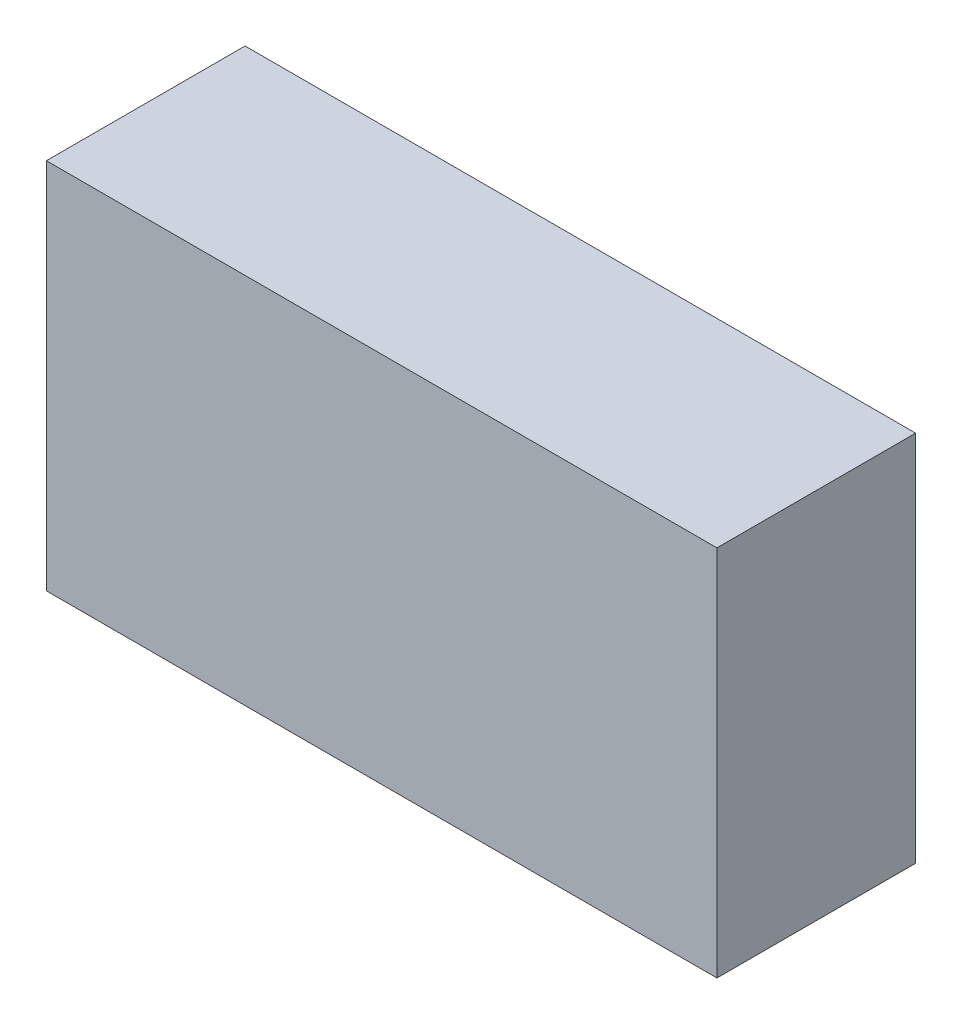
from build123d import *

# Parameters (mm, degrees)
SKETCH1_W           = 54
SKETCH1_H           = 30
BOSS_EXTRUDE1_DEPTH = 16
BOSS_EXTRUDE2_DEPTH = 0.5


with BuildPart() as part:
    # Sketch1 → Boss-Extrude1 (new body)
    with BuildSketch(Plane.XY):
        Rectangle(SKETCH1_W, SKETCH1_H)
    extrude(amount=BOSS_EXTRUDE1_DEPTH)

    # Sketch2 → Boss-Extrude2 (add)
    # profile 1 of 11: a face of its own
    with BuildSketch(Plane(origin=(0, 0, 0), x_dir=(-1, 0, 0), z_dir=(0, 0, -1))):
        Polygon((-12.786080321, 6.26738711), (-10.832234167, 6.26738711), (-12.501144423, 3.010976854), (-12.747283245, 3.146448608), (-11.314335529, 5.941746084), (-12.786080321, 5.941746084), align=None)
    # profile 2 of 11: a face of its own
    with BuildSketch(Plane(origin=(0, 0, 0), x_dir=(-1, 0, 0), z_dir=(0, 0, -1))):
        with BuildLine():
            add(Edge.make_bspline(
                [(-10.038484167, 3.580848648), (-10.02080376, 3.579798026), (-9.98614339, 3.577738403), (-9.936033609, 3.563608135), (-9.890681311, 3.538517778), (-9.850284203, 3.505077972), (-9.816986185, 3.464532621), (-9.791001665, 3.419542046), (-9.776994486, 3.369012745), (-9.774949866, 3.334151539), (-9.773900834, 3.316265315)],
                knots=[0, 0, 0, 0, 1.020151414, 1.999887582, 2.974338812, 3.990962822, 5.007586832, 5.987933904, 6.967670073, 8, 8, 8, 8], degree=3))
            add(Edge.make_bspline(
                [(-9.773900834, 3.316265315), (-9.774985414, 3.298808866), (-9.777124191, 3.264385005), (-9.790969557, 3.214236821), (-9.817184217, 3.169218129), (-9.850054532, 3.128122618), (-9.890691297, 3.094611971), (-9.936140829, 3.06973508), (-9.986025756, 3.054593069), (-10.020784135, 3.052664214), (-10.038484167, 3.051681982)],
                knots=[0, 0, 0, 0, 1.009421747, 1.99056486, 2.972319754, 3.999869655, 5.017953583, 5.993804169, 6.978383603, 8, 8, 8, 8], degree=3))
            add(Edge.make_bspline(
                [(-10.038484167, 3.051681982), (-10.056196953, 3.052628674), (-10.090776951, 3.054476864), (-10.140475674, 3.070045981), (-10.186201995, 3.094378691), (-10.226830848, 3.128185102), (-10.259976462, 3.169006661), (-10.28503663, 3.214546862), (-10.300086265, 3.264241451), (-10.302065536, 3.298780592), (-10.3030675, 3.316265315)],
                knots=[0, 0, 0, 0, 1.022052826, 1.995314843, 2.982371812, 4.00089066, 5.028879526, 6.005146991, 6.990147033, 8, 8, 8, 8], degree=3))
            add(Edge.make_bspline(
                [(-10.3030675, 3.316265315), (-10.302104024, 3.334180824), (-10.300222956, 3.369158656), (-10.285005036, 3.419232132), (-10.260170901, 3.464742073), (-10.226601721, 3.505016114), (-10.186211824, 3.53875031), (-10.140585981, 3.563301943), (-10.090657255, 3.577852889), (-10.056176811, 3.579832743), (-10.038484167, 3.580848648)],
                knots=[0, 0, 0, 0, 1.032775665, 2.016367738, 2.991239715, 4.008302682, 5.025365648, 6.011011707, 6.979408107, 8, 8, 8, 8], degree=3))
        make_face()
    # profile 3 of 11: a face of its own
    with BuildSketch(Plane(origin=(0, 0, 0), x_dir=(-1, 0, 0), z_dir=(0, 0, -1))):
        Polygon((-7.633701515, 6.348797366), (-7.57582391, 6.348797366), (-7.57582391, 4.150720443), (-7.209477757, 4.150720443), (-7.209477757, 3.825079418), (-7.57582391, 3.825079418), (-7.57582391, 3.09238711), (-7.860759808, 3.09238711), (-7.860759808, 3.825079418), (-9.366849551, 3.825079418), align=None)
        Polygon((-7.860759808, 4.150720443), (-7.860759808, 5.529606661), (-8.807154039, 4.150720443), align=None, mode=Mode.SUBTRACT)
    # profile 4 of 11: a face of its own
    with BuildSketch(Plane(origin=(0, 0, 0), x_dir=(-1, 0, 0), z_dir=(0, 0, -1))):
        Polygon((-6.883836731, 6.26738711), (-6.578548269, 6.26738711), (-5.520214936, 3.765293761), (-4.461881603, 6.26738711), (-4.156593141, 6.26738711), (-5.499862372, 3.09238711), (-5.5405675, 3.09238711), align=None)
    # profile 5 of 11: a face of its own
    with BuildSketch(Plane(origin=(0, 0, 0), x_dir=(-1, 0, 0), z_dir=(0, 0, -1))):
        Polygon((-12.314791258, -0.024279557), (-11.727746987, -0.024279557), (-11.727746987, -3.199279557), (-12.012682885, -3.199279557), (-12.012682885, -0.349920582), (-12.501144423, -0.349920582), align=None)
    # profile 6 of 11: a face of its own
    with BuildSketch(Plane(origin=(0, 0, 0), x_dir=(-1, 0, 0), z_dir=(0, 0, -1))):
        with BuildLine():
            add(Edge.make_bspline(
                [(-10.547298269, -1.613051592), (-10.54700071, -1.562163247), (-10.546422697, -1.463311904), (-10.539992486, -1.319271551), (-10.529310569, -1.184143288), (-10.514671666, -1.05792065), (-10.496857213, -0.940571049), (-10.473076021, -0.832408091), (-10.44603155, -0.732931162), (-10.414687546, -0.641815875), (-10.379320052, -0.557834673), (-10.340826115, -0.479434669), (-10.297678052, -0.406734488), (-10.252341852, -0.338573778), (-10.20298233, -0.276068283), (-10.151004141, -0.218335297), (-10.094378582, -0.166709116), (-10.035030568, -0.119677113), (-9.972422775, -0.078447949), (-9.908339785, -0.042132537), (-9.84234051, -0.011108371), (-9.774244759, 0.013285096), (-9.704664581, 0.033433507), (-9.633356742, 0.047212052), (-9.560203505, 0.055881533), (-9.510826417, 0.05671036), (-9.485784848, 0.0571307)],
                knots=[0, 0, 0, 0, 1.646270934, 3.197905019, 4.663502075, 6.030701355, 7.308322542, 8.50163776, 9.611534131, 10.641858119, 11.616356847, 12.558055219, 13.465016945, 14.349605745, 15.204443733, 16.039544428, 16.859896111, 17.680448484, 18.487036065, 19.28249412, 20.06191084, 20.843045899, 21.620316918, 22.403196591, 23.190181807, 24, 24, 24, 24], degree=3))
            add(Edge.make_bspline(
                [(-9.485784848, 0.0571307), (-9.460534092, 0.056688182), (-9.410318284, 0.055808153), (-9.336077373, 0.047350005), (-9.26355159, 0.033315486), (-9.193050135, 0.01343003), (-9.123993898, -0.011240334), (-9.056923014, -0.042162218), (-8.991420875, -0.078156619), (-8.9285284, -0.120451137), (-8.867555142, -0.167606487), (-8.809998776, -0.220912623), (-8.755854062, -0.279831296), (-8.704441464, -0.34373213), (-8.6572196, -0.413840743), (-8.612249415, -0.488937757), (-8.57199764, -0.57033647), (-8.533231185, -0.656678751), (-8.499769418, -0.750353642), (-8.469592181, -0.850833103), (-8.445209117, -0.959303973), (-8.424898848, -1.075197138), (-8.40916455, -1.198938212), (-8.397704939, -1.330261941), (-8.391651498, -1.469254724), (-8.39051149, -1.564285059), (-8.389926475, -1.613051592)],
                knots=[0, 0, 0, 0, 0.810914788, 1.612654377, 2.396697861, 3.181598691, 3.963628158, 4.749916497, 5.551656086, 6.361998678, 7.18212741, 8.025565596, 8.878627764, 9.750805457, 10.657531673, 11.591944965, 12.560506719, 13.57287815, 14.630710178, 15.753379473, 16.941251878, 18.199788006, 19.531962791, 20.947069417, 22.433333509, 24, 24, 24, 24], degree=3))
            add(Edge.make_bspline(
                [(-8.389926475, -1.613051592), (-8.390517555, -1.661605423), (-8.391669251, -1.756210582), (-8.397637077, -1.894577967), (-8.409392407, -2.025204763), (-8.424097182, -2.148404254), (-8.444463413, -2.263663665), (-8.469505242, -2.371381844), (-8.497309464, -2.472023966), (-8.531631027, -2.564765545), (-8.569196457, -2.650900322), (-8.610067956, -2.731334092), (-8.653855584, -2.806777801), (-8.701561089, -2.876627571), (-8.752409542, -2.94137821), (-8.807489251, -2.999886768), (-8.865247567, -3.05356302), (-8.926400259, -3.101325568), (-8.990273594, -3.143131069), (-9.055550757, -3.180517919), (-9.123389969, -3.210664721), (-9.192253862, -3.23655008), (-9.263127451, -3.256326204), (-9.335922391, -3.270000344), (-9.410268405, -3.279590521), (-9.460525539, -3.280322114), (-9.485784848, -3.280689813)],
                knots=[0, 0, 0, 0, 1.561518951, 3.042555995, 4.452378317, 5.7783523, 7.031515105, 8.214008947, 9.334062868, 10.386615937, 11.391082383, 12.354592575, 13.286541444, 14.194233754, 15.072674879, 15.931287219, 16.775624067, 17.606195743, 18.42308326, 19.229000347, 20.022332153, 20.807536673, 21.593273796, 22.3848459, 23.188221202, 24, 24, 24, 24], degree=3))
            add(Edge.make_bspline(
                [(-9.485784848, -3.280689813), (-9.510825723, -3.280266762), (-9.56020144, -3.279432588), (-9.633364712, -3.270802274), (-9.704378071, -3.256927068), (-9.773591941, -3.237499149), (-9.841361423, -3.213718547), (-9.906763054, -3.182736277), (-9.970524024, -3.147054657), (-10.032474221, -3.106418811), (-10.091449539, -3.059862712), (-10.147781845, -3.008369393), (-10.20005597, -2.95065387), (-10.248709756, -2.887627469), (-10.294950536, -2.819870027), (-10.337485897, -2.746456432), (-10.376829457, -2.667677778), (-10.412791766, -2.583025102), (-10.444676625, -2.491263132), (-10.472841332, -2.391342091), (-10.495079175, -2.28238005), (-10.514113713, -2.165252152), (-10.529466546, -2.039455087), (-10.53994797, -1.90492056), (-10.546426163, -1.761732406), (-10.547002262, -1.663516253), (-10.547298269, -1.613051592)],
                knots=[0, 0, 0, 0, 0.810891512, 1.598919785, 2.382837074, 3.152667961, 3.926044502, 4.706494248, 5.493654104, 6.291793342, 7.103789334, 7.925228297, 8.761435821, 9.622817696, 10.50288917, 11.416980706, 12.369136599, 13.353924996, 14.394355917, 15.514179734, 16.714354668, 17.994756427, 19.357759367, 20.818452758, 22.365282078, 24, 24, 24, 24], degree=3))
        make_face()
        with BuildLine():
            add(Edge.make_bspline(
                [(-10.262362372, -1.611779557), (-10.262254016, -1.654187305), (-10.26204372, -1.736492417), (-10.25654988, -1.856093089), (-10.249065741, -1.967644745), (-10.239412565, -2.071289024), (-10.225077033, -2.166675107), (-10.209014447, -2.254459034), (-10.189467251, -2.334176242), (-10.166339628, -2.406373756), (-10.139997018, -2.472276839), (-10.111235271, -2.533600799), (-10.080337329, -2.591070055), (-10.045757814, -2.6441684), (-10.008097721, -2.693068992), (-9.968207693, -2.738637347), (-9.924598992, -2.779274609), (-9.864270597, -2.828012541), (-9.784626652, -2.878376327), (-9.684278096, -2.922233137), (-9.581164573, -2.949794365), (-9.511177367, -2.953299344), (-9.476244584, -2.955048787)],
                knots=[0, 0, 0, 0, 1.459021318, 2.831673884, 4.118529203, 5.306027144, 6.411944654, 7.436330062, 8.375795394, 9.233974572, 10.042671642, 10.816086306, 11.563610507, 12.285937304, 12.993564865, 13.685989202, 14.367179055, 15.041617293, 16.353048772, 17.594441528, 18.799311195, 20, 20, 20, 20], degree=3))
            add(Edge.make_bspline(
                [(-9.476244584, -2.955048787), (-9.441085839, -2.953599372), (-9.370840938, -2.950703534), (-9.268212424, -2.922764679), (-9.168580679, -2.880610168), (-9.090501133, -2.830764931), (-9.031099112, -2.783295661), (-8.988538699, -2.742823801), (-8.94947527, -2.697506693), (-8.912425673, -2.648612332), (-8.87844494, -2.595206578), (-8.847544808, -2.537546242), (-8.819347771, -2.475471202), (-8.803283137, -2.432137225), (-8.795069704, -2.40998168)],
                knots=[0, 0, 0, 0, 1.353760809, 2.704726607, 4.075137775, 5.516104923, 6.260822281, 7.007110065, 7.778089737, 8.566572457, 9.372053459, 10.217411131, 11.088608312, 12, 12, 12, 12], degree=3))
            add(Edge.make_bspline(
                [(-8.795069704, -2.40998168), (-8.785497743, -2.381651845), (-8.766062558, -2.32413013), (-8.741014734, -2.234900246), (-8.72128855, -2.141280596), (-8.703541783, -2.043830668), (-8.691428653, -1.941831797), (-8.681678851, -1.835599577), (-8.675936014, -1.725053913), (-8.675224133, -1.649947028), (-8.674862372, -1.611779557)],
                knots=[0, 0, 0, 0, 0.884706709, 1.796334032, 2.740027952, 3.714592787, 4.726048262, 5.777819803, 6.87074269, 8, 8, 8, 8], degree=3))
            add(Edge.make_bspline(
                [(-8.674862372, -1.611779557), (-8.675361472, -1.573618259), (-8.676337819, -1.498966602), (-8.680069794, -1.389639395), (-8.689706893, -1.285800784), (-8.70041038, -1.187003426), (-8.716192144, -1.093794223), (-8.733208155, -1.005392875), (-8.756069255, -0.922894559), (-8.780489336, -0.845007653), (-8.808438767, -0.772617059), (-8.839205183, -0.705385268), (-8.872063492, -0.642987696), (-8.907752525, -0.585595542), (-8.945848609, -0.532951735), (-8.987357243, -0.486111781), (-9.030631924, -0.44362396), (-9.091244657, -0.395125772), (-9.170596334, -0.345675877), (-9.269334885, -0.300168367), (-9.372087541, -0.27403513), (-9.441550603, -0.270350599), (-9.476244584, -0.268510326)],
                knots=[0, 0, 0, 0, 1.31362396, 2.569729283, 3.763502607, 4.902122613, 5.988968491, 7.01645872, 7.998833611, 8.933434873, 9.825090667, 10.667526885, 11.477055099, 12.250526234, 12.991942729, 13.710640831, 14.402115721, 15.076753259, 16.378508321, 17.609869233, 18.806226677, 20, 20, 20, 20], degree=3))
            add(Edge.make_bspline(
                [(-9.476244584, -0.268510326), (-9.511360621, -0.270353138), (-9.581656668, -0.27404212), (-9.685477313, -0.300071), (-9.784994831, -0.345439905), (-9.864136673, -0.395289557), (-9.924791679, -0.442767882), (-9.967502408, -0.48393988), (-10.007549293, -0.528976125), (-10.044440707, -0.578326434), (-10.078993128, -0.631362874), (-10.110725904, -0.688502682), (-10.139316624, -0.750035419), (-10.165700453, -0.8159089), (-10.188898625, -0.888100185), (-10.208033863, -0.967719201), (-10.225711404, -1.055223917), (-10.238225684, -1.151126614), (-10.249350662, -1.254796853), (-10.256500171, -1.366626991), (-10.262062097, -1.486428251), (-10.262260276, -1.569158916), (-10.262362372, -1.611779557)],
                knots=[0, 0, 0, 0, 1.207732386, 2.417664972, 3.655092373, 4.956220595, 5.625982001, 6.301752483, 6.994047911, 7.697131622, 8.419323945, 9.170223765, 9.943494443, 10.752040957, 11.610060368, 12.549350801, 13.567764191, 14.679664412, 15.874934091, 17.154273443, 18.533957287, 20, 20, 20, 20], degree=3))
        make_face(mode=Mode.SUBTRACT)
    # profile 7 of 11: a face of its own
    with BuildSketch(Plane(origin=(0, 0, 0), x_dir=(-1, 0, 0), z_dir=(0, 0, -1))):
        with BuildLine():
            add(Edge.make_bspline(
                [(-8.104990577, -1.613051592), (-8.104693018, -1.562163247), (-8.104115005, -1.463311904), (-8.097684794, -1.319271551), (-8.087002876, -1.184143288), (-8.072363974, -1.05792065), (-8.05454952, -0.940571049), (-8.030768329, -0.832408091), (-8.003723858, -0.732931162), (-7.972379854, -0.641815875), (-7.937012359, -0.557834673), (-7.898518423, -0.479434669), (-7.855370359, -0.406734488), (-7.81003416, -0.338573778), (-7.760674638, -0.276068283), (-7.708696449, -0.218335297), (-7.65207089, -0.166709116), (-7.592722875, -0.119677113), (-7.530115083, -0.078447949), (-7.466032093, -0.042132537), (-7.400032818, -0.011108371), (-7.331937066, 0.013285096), (-7.262356889, 0.033433507), (-7.19104905, 0.047212052), (-7.117895812, 0.055881533), (-7.068518725, 0.05671036), (-7.043477156, 0.0571307)],
                knots=[0, 0, 0, 0, 1.646270934, 3.197905019, 4.663502075, 6.030701355, 7.308322542, 8.50163776, 9.611534131, 10.641858119, 11.616356847, 12.558055219, 13.465016945, 14.349605745, 15.204443733, 16.039544428, 16.859896111, 17.680448484, 18.487036065, 19.28249412, 20.06191084, 20.843045899, 21.620316918, 22.403196591, 23.190181807, 24, 24, 24, 24], degree=3))
            add(Edge.make_bspline(
                [(-7.043477156, 0.0571307), (-7.0182264, 0.056688182), (-6.968010592, 0.055808153), (-6.89376968, 0.047350005), (-6.821243898, 0.033315486), (-6.750742443, 0.01343003), (-6.681686205, -0.011240334), (-6.614615321, -0.042162218), (-6.549113183, -0.078156619), (-6.486220708, -0.120451137), (-6.42524745, -0.167606487), (-6.367691083, -0.220912623), (-6.31354637, -0.279831296), (-6.262133771, -0.34373213), (-6.214911908, -0.413840743), (-6.169941723, -0.488937757), (-6.129689948, -0.57033647), (-6.090923492, -0.656678751), (-6.057461726, -0.750353642), (-6.027284489, -0.850833103), (-6.002901425, -0.959303973), (-5.982591156, -1.075197138), (-5.966856858, -1.198938212), (-5.955397247, -1.330261941), (-5.949343805, -1.469254724), (-5.948203798, -1.564285059), (-5.947618782, -1.613051592)],
                knots=[0, 0, 0, 0, 0.810914788, 1.612654377, 2.396697861, 3.181598691, 3.963628158, 4.749916497, 5.551656086, 6.361998678, 7.18212741, 8.025565596, 8.878627764, 9.750805457, 10.657531673, 11.591944965, 12.560506719, 13.57287815, 14.630710178, 15.753379473, 16.941251878, 18.199788006, 19.531962791, 20.947069417, 22.433333509, 24, 24, 24, 24], degree=3))
            add(Edge.make_bspline(
                [(-5.947618782, -1.613051592), (-5.948209863, -1.661605423), (-5.949361558, -1.756210582), (-5.955329385, -1.894577967), (-5.967084715, -2.025204763), (-5.98178949, -2.148404254), (-6.002155721, -2.263663665), (-6.02719755, -2.371381844), (-6.055001771, -2.472023966), (-6.089323335, -2.564765545), (-6.126888765, -2.650900322), (-6.167760264, -2.731334092), (-6.211547892, -2.806777801), (-6.259253397, -2.876627571), (-6.31010185, -2.94137821), (-6.365181558, -2.999886768), (-6.422939875, -3.05356302), (-6.484092566, -3.101325568), (-6.547965902, -3.143131069), (-6.613243065, -3.180517919), (-6.681082277, -3.210664721), (-6.74994617, -3.23655008), (-6.820819759, -3.256326204), (-6.893614699, -3.270000344), (-6.967960713, -3.279590521), (-7.018217847, -3.280322114), (-7.043477156, -3.280689813)],
                knots=[0, 0, 0, 0, 1.561518951, 3.042555995, 4.452378317, 5.7783523, 7.031515105, 8.214008947, 9.334062868, 10.386615937, 11.391082383, 12.354592575, 13.286541444, 14.194233754, 15.072674879, 15.931287219, 16.775624067, 17.606195743, 18.42308326, 19.229000347, 20.022332153, 20.807536673, 21.593273796, 22.3848459, 23.188221202, 24, 24, 24, 24], degree=3))
            add(Edge.make_bspline(
                [(-7.043477156, -3.280689813), (-7.06851803, -3.280266762), (-7.117893748, -3.279432588), (-7.19105702, -3.270802274), (-7.262070379, -3.256927068), (-7.331284249, -3.237499149), (-7.39905373, -3.213718547), (-7.464455362, -3.182736277), (-7.528216332, -3.147054657), (-7.590166529, -3.106418811), (-7.649141847, -3.059862712), (-7.705474153, -3.008369393), (-7.757748277, -2.95065387), (-7.806402064, -2.887627469), (-7.852642844, -2.819870027), (-7.895178204, -2.746456432), (-7.934521765, -2.667677778), (-7.970484074, -2.583025102), (-8.002368933, -2.491263132), (-8.03053364, -2.391342091), (-8.052771483, -2.28238005), (-8.071806021, -2.165252152), (-8.087158854, -2.039455087), (-8.097640278, -1.90492056), (-8.10411847, -1.761732406), (-8.10469457, -1.663516253), (-8.104990577, -1.613051592)],
                knots=[0, 0, 0, 0, 0.810891512, 1.598919785, 2.382837074, 3.152667961, 3.926044502, 4.706494248, 5.493654104, 6.291793342, 7.103789334, 7.925228297, 8.761435821, 9.622817696, 10.50288917, 11.416980706, 12.369136599, 13.353924996, 14.394355917, 15.514179734, 16.714354668, 17.994756427, 19.357759367, 20.818452758, 22.365282078, 24, 24, 24, 24], degree=3))
        make_face()
        with BuildLine():
            add(Edge.make_bspline(
                [(-7.82005468, -1.611779557), (-7.819946324, -1.654187305), (-7.819736027, -1.736492417), (-7.814242188, -1.856093089), (-7.806758049, -1.967644745), (-7.797104872, -2.071289024), (-7.782769341, -2.166675107), (-7.766706754, -2.254459034), (-7.747159559, -2.334176242), (-7.724031936, -2.406373756), (-7.697689326, -2.472276839), (-7.668927578, -2.533600799), (-7.638029637, -2.591070055), (-7.603450122, -2.6441684), (-7.565790029, -2.693068992), (-7.525900001, -2.738637347), (-7.482291299, -2.779274609), (-7.421962904, -2.828012541), (-7.34231896, -2.878376327), (-7.241970404, -2.922233137), (-7.13885688, -2.949794365), (-7.068869675, -2.953299344), (-7.033936891, -2.955048787)],
                knots=[0, 0, 0, 0, 1.459021318, 2.831673884, 4.118529203, 5.306027144, 6.411944654, 7.436330062, 8.375795394, 9.233974572, 10.042671642, 10.816086306, 11.563610507, 12.285937304, 12.993564865, 13.685989202, 14.367179055, 15.041617293, 16.353048772, 17.594441528, 18.799311195, 20, 20, 20, 20], degree=3))
            add(Edge.make_bspline(
                [(-7.033936891, -2.955048787), (-6.998778146, -2.953599372), (-6.928533246, -2.950703534), (-6.825904732, -2.922764679), (-6.726272987, -2.880610168), (-6.648193441, -2.830764931), (-6.588791419, -2.783295661), (-6.546231007, -2.742823801), (-6.507167577, -2.697506693), (-6.470117981, -2.648612332), (-6.436137248, -2.595206578), (-6.405237116, -2.537546242), (-6.377040079, -2.475471202), (-6.360975444, -2.432137225), (-6.352762011, -2.40998168)],
                knots=[0, 0, 0, 0, 1.353760809, 2.704726607, 4.075137775, 5.516104923, 6.260822281, 7.007110065, 7.778089737, 8.566572457, 9.372053459, 10.217411131, 11.088608312, 12, 12, 12, 12], degree=3))
            add(Edge.make_bspline(
                [(-6.352762011, -2.40998168), (-6.343190051, -2.381651845), (-6.323754865, -2.32413013), (-6.298707041, -2.234900246), (-6.278980858, -2.141280596), (-6.26123409, -2.043830668), (-6.249120961, -1.941831797), (-6.239371159, -1.835599577), (-6.233628322, -1.725053913), (-6.23291644, -1.649947028), (-6.23255468, -1.611779557)],
                knots=[0, 0, 0, 0, 0.884706709, 1.796334032, 2.740027952, 3.714592787, 4.726048262, 5.777819803, 6.87074269, 8, 8, 8, 8], degree=3))
            add(Edge.make_bspline(
                [(-6.23255468, -1.611779557), (-6.23305378, -1.573618259), (-6.234030127, -1.498966602), (-6.237762101, -1.389639395), (-6.247399201, -1.285800784), (-6.258102687, -1.187003426), (-6.273884452, -1.093794223), (-6.290900463, -1.005392875), (-6.313761562, -0.922894559), (-6.338181644, -0.845007653), (-6.366131074, -0.772617059), (-6.39689749, -0.705385268), (-6.4297558, -0.642987696), (-6.465444832, -0.585595542), (-6.503540916, -0.532951735), (-6.54504955, -0.486111781), (-6.588324231, -0.44362396), (-6.648936964, -0.395125772), (-6.728288641, -0.345675877), (-6.827027193, -0.300168367), (-6.929779849, -0.27403513), (-6.999242911, -0.270350599), (-7.033936891, -0.268510326)],
                knots=[0, 0, 0, 0, 1.31362396, 2.569729283, 3.763502607, 4.902122613, 5.988968491, 7.01645872, 7.998833611, 8.933434873, 9.825090667, 10.667526885, 11.477055099, 12.250526234, 12.991942729, 13.710640831, 14.402115721, 15.076753259, 16.378508321, 17.609869233, 18.806226677, 20, 20, 20, 20], degree=3))
            add(Edge.make_bspline(
                [(-7.033936891, -0.268510326), (-7.069052928, -0.270353138), (-7.139348976, -0.27404212), (-7.24316962, -0.300071), (-7.342687139, -0.345439905), (-7.421828981, -0.395289557), (-7.482483987, -0.442767882), (-7.525194716, -0.48393988), (-7.565241601, -0.528976125), (-7.602133014, -0.578326434), (-7.636685436, -0.631362874), (-7.668418211, -0.688502682), (-7.697008932, -0.750035419), (-7.723392761, -0.8159089), (-7.746590933, -0.888100185), (-7.765726171, -0.967719201), (-7.783403712, -1.055223917), (-7.795917992, -1.151126614), (-7.80704297, -1.254796853), (-7.814192479, -1.366626991), (-7.819754405, -1.486428251), (-7.819952583, -1.569158916), (-7.82005468, -1.611779557)],
                knots=[0, 0, 0, 0, 1.207732386, 2.417664972, 3.655092373, 4.956220595, 5.625982001, 6.301752483, 6.994047911, 7.697131622, 8.419323945, 9.170223765, 9.943494443, 10.752040957, 11.610060368, 12.549350801, 13.567764191, 14.679664412, 15.874934091, 17.154273443, 18.533957287, 20, 20, 20, 20], degree=3))
        make_face(mode=Mode.SUBTRACT)
    # profile 8 of 11: a face of its own
    with BuildSketch(Plane(origin=(0, 0, 0), x_dir=(-1, 0, 0), z_dir=(0, 0, -1))):
        with BuildLine():
            add(Edge.make_bspline(
                [(-5.662682885, -1.613051592), (-5.662385325, -1.562163247), (-5.661807312, -1.463311904), (-5.655377102, -1.319271551), (-5.644695184, -1.184143288), (-5.630056282, -1.05792065), (-5.612241828, -0.940571049), (-5.588460637, -0.832408091), (-5.561416166, -0.732931162), (-5.530072161, -0.641815875), (-5.494704667, -0.557834673), (-5.45621073, -0.479434669), (-5.413062667, -0.406734488), (-5.367726467, -0.338573778), (-5.318366945, -0.276068283), (-5.266388757, -0.218335297), (-5.209763198, -0.166709116), (-5.150415183, -0.119677113), (-5.08780739, -0.078447949), (-5.0237244, -0.042132537), (-4.957725126, -0.011108371), (-4.889629374, 0.013285096), (-4.820049196, 0.033433507), (-4.748741357, 0.047212052), (-4.67558812, 0.055881533), (-4.626211033, 0.05671036), (-4.601169463, 0.0571307)],
                knots=[0, 0, 0, 0, 1.646270934, 3.197905019, 4.663502075, 6.030701355, 7.308322542, 8.50163776, 9.611534131, 10.641858119, 11.616356847, 12.558055219, 13.465016945, 14.349605745, 15.204443733, 16.039544428, 16.859896111, 17.680448484, 18.487036065, 19.28249412, 20.06191084, 20.843045899, 21.620316918, 22.403196591, 23.190181807, 24, 24, 24, 24], degree=3))
            add(Edge.make_bspline(
                [(-4.601169463, 0.0571307), (-4.575918708, 0.056688182), (-4.5257029, 0.055808153), (-4.451461988, 0.047350005), (-4.378936205, 0.033315486), (-4.308434751, 0.01343003), (-4.239378513, -0.011240334), (-4.172307629, -0.042162218), (-4.106805491, -0.078156619), (-4.043913016, -0.120451137), (-3.982939757, -0.167606487), (-3.925383391, -0.220912623), (-3.871238677, -0.279831296), (-3.819826079, -0.34373213), (-3.772604216, -0.413840743), (-3.727634031, -0.488937757), (-3.687382255, -0.57033647), (-3.6486158, -0.656678751), (-3.615154033, -0.750353642), (-3.584976797, -0.850833103), (-3.560593732, -0.959303973), (-3.540283464, -1.075197138), (-3.524549165, -1.198938212), (-3.513089554, -1.330261941), (-3.507036113, -1.469254724), (-3.505896105, -1.564285059), (-3.50531109, -1.613051592)],
                knots=[0, 0, 0, 0, 0.810914788, 1.612654377, 2.396697861, 3.181598691, 3.963628158, 4.749916497, 5.551656086, 6.361998678, 7.18212741, 8.025565596, 8.878627764, 9.750805457, 10.657531673, 11.591944965, 12.560506719, 13.57287815, 14.630710178, 15.753379473, 16.941251878, 18.199788006, 19.531962791, 20.947069417, 22.433333509, 24, 24, 24, 24], degree=3))
            add(Edge.make_bspline(
                [(-3.50531109, -1.613051592), (-3.50590217, -1.661605423), (-3.507053866, -1.756210582), (-3.513021693, -1.894577967), (-3.524777023, -2.025204763), (-3.539481798, -2.148404254), (-3.559848028, -2.263663665), (-3.584889858, -2.371381844), (-3.612694079, -2.472023966), (-3.647015642, -2.564765545), (-3.684581072, -2.650900322), (-3.725452572, -2.731334092), (-3.7692402, -2.806777801), (-3.816945704, -2.876627571), (-3.867794158, -2.94137821), (-3.922873866, -2.999886768), (-3.980632183, -3.05356302), (-4.041784874, -3.101325568), (-4.10565821, -3.143131069), (-4.170935372, -3.180517919), (-4.238774584, -3.210664721), (-4.307638477, -3.23655008), (-4.378512067, -3.256326204), (-4.451307007, -3.270000344), (-4.525653021, -3.279590521), (-4.575910155, -3.280322114), (-4.601169463, -3.280689813)],
                knots=[0, 0, 0, 0, 1.561518951, 3.042555995, 4.452378317, 5.7783523, 7.031515105, 8.214008947, 9.334062868, 10.386615937, 11.391082383, 12.354592575, 13.286541444, 14.194233754, 15.072674879, 15.931287219, 16.775624067, 17.606195743, 18.42308326, 19.229000347, 20.022332153, 20.807536673, 21.593273796, 22.3848459, 23.188221202, 24, 24, 24, 24], degree=3))
            add(Edge.make_bspline(
                [(-4.601169463, -3.280689813), (-4.626210338, -3.280266762), (-4.675586056, -3.279432588), (-4.748749327, -3.270802274), (-4.819762687, -3.256927068), (-4.888976556, -3.237499149), (-4.956746038, -3.213718547), (-5.022147669, -3.182736277), (-5.08590864, -3.147054657), (-5.147858837, -3.106418811), (-5.206834154, -3.059862712), (-5.263166461, -3.008369393), (-5.315440585, -2.95065387), (-5.364094372, -2.887627469), (-5.410335152, -2.819870027), (-5.452870512, -2.746456432), (-5.492214072, -2.667677778), (-5.528176382, -2.583025102), (-5.560061241, -2.491263132), (-5.588225947, -2.391342091), (-5.61046379, -2.28238005), (-5.629498328, -2.165252152), (-5.644851162, -2.039455087), (-5.655332585, -1.90492056), (-5.661810778, -1.761732406), (-5.662386878, -1.663516253), (-5.662682885, -1.613051592)],
                knots=[0, 0, 0, 0, 0.810891512, 1.598919785, 2.382837074, 3.152667961, 3.926044502, 4.706494248, 5.493654104, 6.291793342, 7.103789334, 7.925228297, 8.761435821, 9.622817696, 10.50288917, 11.416980706, 12.369136599, 13.353924996, 14.394355917, 15.514179734, 16.714354668, 17.994756427, 19.357759367, 20.818452758, 22.365282078, 24, 24, 24, 24], degree=3))
        make_face()
        with BuildLine():
            add(Edge.make_bspline(
                [(-5.377746987, -1.611779557), (-5.377638632, -1.654187305), (-5.377428335, -1.736492417), (-5.371934496, -1.856093089), (-5.364450357, -1.967644745), (-5.35479718, -2.071289024), (-5.340461648, -2.166675107), (-5.324399062, -2.254459034), (-5.304851867, -2.334176242), (-5.281724243, -2.406373756), (-5.255381634, -2.472276839), (-5.226619886, -2.533600799), (-5.195721945, -2.591070055), (-5.161142429, -2.6441684), (-5.123482336, -2.693068992), (-5.083592308, -2.738637347), (-5.039983607, -2.779274609), (-4.979655212, -2.828012541), (-4.900011267, -2.878376327), (-4.799662712, -2.922233137), (-4.696549188, -2.949794365), (-4.626561983, -2.953299344), (-4.591629199, -2.955048787)],
                knots=[0, 0, 0, 0, 1.459021318, 2.831673884, 4.118529203, 5.306027144, 6.411944654, 7.436330062, 8.375795394, 9.233974572, 10.042671642, 10.816086306, 11.563610507, 12.285937304, 12.993564865, 13.685989202, 14.367179055, 15.041617293, 16.353048772, 17.594441528, 18.799311195, 20, 20, 20, 20], degree=3))
            add(Edge.make_bspline(
                [(-4.591629199, -2.955048787), (-4.556470454, -2.953599372), (-4.486225554, -2.950703534), (-4.383597039, -2.922764679), (-4.283965294, -2.880610168), (-4.205885749, -2.830764931), (-4.146483727, -2.783295661), (-4.103923315, -2.742823801), (-4.064859885, -2.697506693), (-4.027810288, -2.648612332), (-3.993829555, -2.595206578), (-3.962929423, -2.537546242), (-3.934732387, -2.475471202), (-3.918667752, -2.432137225), (-3.910454319, -2.40998168)],
                knots=[0, 0, 0, 0, 1.353760809, 2.704726607, 4.075137775, 5.516104923, 6.260822281, 7.007110065, 7.778089737, 8.566572457, 9.372053459, 10.217411131, 11.088608312, 12, 12, 12, 12], degree=3))
            add(Edge.make_bspline(
                [(-3.910454319, -2.40998168), (-3.900882358, -2.381651845), (-3.881447173, -2.32413013), (-3.856399349, -2.234900246), (-3.836673166, -2.141280596), (-3.818926398, -2.043830668), (-3.806813269, -1.941831797), (-3.797063467, -1.835599577), (-3.791320629, -1.725053913), (-3.790608748, -1.649947028), (-3.790246987, -1.611779557)],
                knots=[0, 0, 0, 0, 0.884706709, 1.796334032, 2.740027952, 3.714592787, 4.726048262, 5.777819803, 6.87074269, 8, 8, 8, 8], degree=3))
            add(Edge.make_bspline(
                [(-3.790246987, -1.611779557), (-3.790746088, -1.573618259), (-3.791722434, -1.498966602), (-3.795454409, -1.389639395), (-3.805091509, -1.285800784), (-3.815794995, -1.187003426), (-3.83157676, -1.093794223), (-3.84859277, -1.005392875), (-3.87145387, -0.922894559), (-3.895873952, -0.845007653), (-3.923823382, -0.772617059), (-3.954589798, -0.705385268), (-3.987448108, -0.642987696), (-4.02313714, -0.585595542), (-4.061233224, -0.532951735), (-4.102741858, -0.486111781), (-4.146016539, -0.44362396), (-4.206629272, -0.395125772), (-4.285980949, -0.345675877), (-4.384719501, -0.300168367), (-4.487472156, -0.27403513), (-4.556935218, -0.270350599), (-4.591629199, -0.268510326)],
                knots=[0, 0, 0, 0, 1.31362396, 2.569729283, 3.763502607, 4.902122613, 5.988968491, 7.01645872, 7.998833611, 8.933434873, 9.825090667, 10.667526885, 11.477055099, 12.250526234, 12.991942729, 13.710640831, 14.402115721, 15.076753259, 16.378508321, 17.609869233, 18.806226677, 20, 20, 20, 20], degree=3))
            add(Edge.make_bspline(
                [(-4.591629199, -0.268510326), (-4.626745236, -0.270353138), (-4.697041283, -0.27404212), (-4.800861928, -0.300071), (-4.900379447, -0.345439905), (-4.979521288, -0.395289557), (-5.040176295, -0.442767882), (-5.082887024, -0.48393988), (-5.122933908, -0.528976125), (-5.159825322, -0.578326434), (-5.194377743, -0.631362874), (-5.226110519, -0.688502682), (-5.254701239, -0.750035419), (-5.281085069, -0.8159089), (-5.304283241, -0.888100185), (-5.323418479, -0.967719201), (-5.34109602, -1.055223917), (-5.353610299, -1.151126614), (-5.364735278, -1.254796853), (-5.371884786, -1.366626991), (-5.377446713, -1.486428251), (-5.377644891, -1.569158916), (-5.377746987, -1.611779557)],
                knots=[0, 0, 0, 0, 1.207732386, 2.417664972, 3.655092373, 4.956220595, 5.625982001, 6.301752483, 6.994047911, 7.697131622, 8.419323945, 9.170223765, 9.943494443, 10.752040957, 11.610060368, 12.549350801, 13.567764191, 14.679664412, 15.874934091, 17.154273443, 18.533957287, 20, 20, 20, 20], degree=3))
        make_face(mode=Mode.SUBTRACT)
    # profile 9 of 11: a face of its own
    with BuildSketch(Plane(origin=(0, 0, 0), x_dir=(-1, 0, 0), z_dir=(0, 0, -1))):
        with BuildLine():
            Line((-3.016849551, -0.879087249), (-2.731913654, -0.879087249))
            Line((-2.731913654, -0.879087249), (-2.731913654, -1.282322425))
            add(Edge.make_bspline(
                [(-2.731913654, -1.282322425), (-2.706256071, -1.247045815), (-2.657093682, -1.179452448), (-2.57647984, -1.090379833), (-2.495947224, -1.014789293), (-2.437950513, -0.975108259), (-2.410088734, -0.956045382)],
                knots=[0, 0, 0, 0, 1.134379233, 2.173579362, 3.122582517, 4, 4, 4, 4], degree=3))
            add(Edge.make_bspline(
                [(-2.410088734, -0.956045382), (-2.372111505, -0.937897658), (-2.296820553, -0.901919271), (-2.177604542, -0.865421686), (-2.055616806, -0.842992487), (-1.973240783, -0.839925098), (-1.931803478, -0.838382121)],
                knots=[0, 0, 0, 0, 1.014936303, 2.012140481, 3.000054389, 4, 4, 4, 4], degree=3))
            add(Edge.make_bspline(
                [(-1.931803478, -0.838382121), (-1.903779117, -0.839330349), (-1.848320413, -0.841206841), (-1.766147702, -0.853417016), (-1.68644739, -0.874522759), (-1.609690378, -0.903920831), (-1.537372333, -0.939523183), (-1.47106999, -0.981296846), (-1.411539458, -1.028193479), (-1.358810826, -1.082330797), (-1.311395352, -1.145228997), (-1.26778097, -1.218584423), (-1.227480956, -1.30404423), (-1.205145912, -1.366062449), (-1.193387011, -1.398713651)],
                knots=[0, 0, 0, 0, 1.009824226, 1.998387844, 2.986035974, 3.974953746, 4.955485308, 5.885931332, 6.793869504, 7.679848016, 8.601185859, 9.625726857, 10.749998409, 12, 12, 12, 12], degree=3))
            add(Edge.make_bspline(
                [(-1.193387011, -1.398713651), (-1.180948948, -1.376285071), (-1.156472585, -1.332148775), (-1.1153739, -1.269684494), (-1.072313827, -1.211258333), (-1.026925394, -1.156823933), (-0.979368805, -1.106650106), (-0.929420249, -1.060570967), (-0.877364054, -1.01838863), (-0.804981094, -0.969109764), (-0.710808229, -0.91676655), (-0.59207401, -0.871383604), (-0.468566355, -0.843338259), (-0.3847303, -0.840045083), (-0.342395425, -0.838382121)],
                knots=[0, 0, 0, 0, 0.86119277, 1.694706429, 2.50939023, 3.298075842, 4.073795165, 4.829715201, 5.57930267, 6.321991688, 7.768977793, 9.186738141, 10.579381044, 12, 12, 12, 12], degree=3))
            add(Edge.make_bspline(
                [(-0.342395425, -0.838382121), (-0.303495812, -0.839849171), (-0.227365493, -0.842720331), (-0.116533259, -0.865265982), (-0.013171764, -0.903980705), (0.082511012, -0.956806932), (0.168834557, -1.023190906), (0.243870066, -1.10217478), (0.307161753, -1.193199873), (0.34850809, -1.278826892), (0.376552651, -1.354423944), (0.393843914, -1.418836794), (0.409119923, -1.489731417), (0.42180291, -1.567192582), (0.431072596, -1.65149392), (0.437940317, -1.742497472), (0.442588583, -1.840273966), (0.442917035, -1.907734098), (0.443086346, -1.942508723)],
                knots=[0, 0, 0, 0, 1.209669288, 2.367440248, 3.500751976, 4.631527125, 5.755587489, 6.87532382, 8.007944318, 9.190864318, 9.82315674, 10.514484317, 11.263564316, 12.079023757, 12.955305781, 13.901327259, 14.918167583, 16, 16, 16, 16], degree=3))
            Line((0.443086346, -1.942508723), (0.443086346, -3.199279557))
            Line((0.443086346, -3.199279557), (0.158150449, -3.199279557))
            Line((0.158150449, -3.199279557), (0.158150449, -1.941236688))
            add(Edge.make_bspline(
                [(0.158150449, -1.941236688), (0.158079798, -1.911554453), (0.157944017, -1.854509712), (0.155500508, -1.772637845), (0.150896474, -1.698008693), (0.145512908, -1.630724013), (0.138034596, -1.570626897), (0.128377215, -1.517838061), (0.118146748, -1.471942246), (0.101150527, -1.421064189), (0.073983511, -1.364939069), (0.03260194, -1.304411254), (-0.019531656, -1.251723671), (-0.079729798, -1.205987055), (-0.14826303, -1.168799966), (-0.223796029, -1.142242443), (-0.305859847, -1.125802403), (-0.362667662, -1.124164089), (-0.3920048, -1.123318018)],
                knots=[0, 0, 0, 0, 1.253487763, 2.409012846, 3.458416907, 4.410876679, 5.259312806, 6.014470957, 6.676830364, 7.243083969, 8.276244668, 9.299465089, 10.325150304, 11.392391894, 12.482080715, 13.603491619, 14.762376348, 16, 16, 16, 16], degree=3))
            add(Edge.make_bspline(
                [(-0.3920048, -1.123318018), (-0.427991116, -1.124602675), (-0.499113756, -1.127141646), (-0.602932162, -1.153062231), (-0.702691584, -1.192142172), (-0.795415312, -1.24877733), (-0.88071195, -1.316639203), (-0.954099425, -1.397329193), (-1.014725764, -1.488614913), (-1.055777585, -1.573112278), (-1.081712166, -1.649012417), (-1.098836225, -1.715322176), (-1.112156159, -1.790689027), (-1.124647996, -1.874606536), (-1.132801149, -1.967652343), (-1.14021103, -2.069396035), (-1.143677098, -2.180143627), (-1.144161929, -2.256912123), (-1.144413654, -2.296770542)],
                knots=[0, 0, 0, 0, 1.090531906, 2.155305635, 3.229839962, 4.33261226, 5.44038871, 6.529323825, 7.629011124, 8.757537029, 9.370236727, 10.061839251, 10.834451254, 11.692844982, 12.636905849, 13.66920014, 14.789842145, 16, 16, 16, 16], degree=3))
            Line((-1.144413654, -2.296770542), (-1.144413654, -3.199279557))
            Line((-1.144413654, -3.199279557), (-1.429349551, -3.199279557))
            Line((-1.429349551, -3.199279557), (-1.429349551, -2.019466856))
            add(Edge.make_bspline(
                [(-1.429349551, -2.019466856), (-1.429421607, -1.986180774), (-1.429560234, -1.922141698), (-1.431988036, -1.830308293), (-1.436602328, -1.746777599), (-1.441936826, -1.671646699), (-1.449611416, -1.605052137), (-1.458328843, -1.546636892), (-1.468623654, -1.496547411), (-1.485668764, -1.441607769), (-1.511716889, -1.38108236), (-1.553616241, -1.316547291), (-1.605874546, -1.260061231), (-1.667170983, -1.211838652), (-1.736118995, -1.171977451), (-1.812303937, -1.143257533), (-1.895039822, -1.126544071), (-1.952078884, -1.124413649), (-1.981412853, -1.123318018)],
                knots=[0, 0, 0, 0, 1.320475261, 2.540461679, 3.643808994, 4.639130445, 5.527981419, 6.302341397, 6.981980563, 7.553956391, 8.582137848, 9.585246428, 10.591171744, 11.620968678, 12.668337649, 13.738356861, 14.836885341, 16, 16, 16, 16], degree=3))
            add(Edge.make_bspline(
                [(-1.981412853, -1.123318018), (-2.015898987, -1.124706364), (-2.084628629, -1.127473288), (-2.185595416, -1.152378237), (-2.283100286, -1.191389076), (-2.375587763, -1.245509055), (-2.460563597, -1.312546076), (-2.534956811, -1.391390303), (-2.597497531, -1.481060497), (-2.63898282, -1.56466688), (-2.66574215, -1.638665494), (-2.683517918, -1.701576711), (-2.698793864, -1.771426936), (-2.71014587, -1.848431672), (-2.721104532, -1.932089379), (-2.726393456, -2.022816809), (-2.731538373, -2.120536132), (-2.731785492, -2.188002655), (-2.731913654, -2.222992497)],
                knots=[0, 0, 0, 0, 1.098833095, 2.189935336, 3.297829714, 4.440610912, 5.596351641, 6.740013378, 7.886572111, 9.072425424, 9.705826452, 10.395263256, 11.156850408, 11.985370555, 12.878090359, 13.847760091, 14.883794034, 16, 16, 16, 16], degree=3))
            Line((-2.731913654, -2.222992497), (-2.731913654, -3.199279557))
            Line((-2.731913654, -3.199279557), (-3.016849551, -3.199279557))
            Line((-3.016849551, -3.199279557), (-3.016849551, -0.879087249))
        make_face()
    # profile 10 of 11: a face of its own
    with BuildSketch(Plane(origin=(0, 0, 0), x_dir=(-1, 0, 0), z_dir=(0, 0, -1))):
        Polygon((2.478342756, -0.024279557), (3.943727372, -3.199279557), (3.633986787, -3.199279557), (3.164605777, -2.181651352), (1.725297884, -2.181651352), (1.242560505, -3.199279557), (0.931547884, -3.199279557), (2.437637628, -0.024279557), align=None)
        Polygon((2.454810104, -0.643124709), (1.879850168, -1.856010326), (3.014505617, -1.856010326), align=None, mode=Mode.SUBTRACT)
    # profile 11 of 11: a face of its own
    with BuildSketch(Plane(origin=(0, 0, 0), x_dir=(-1, 0, 0), z_dir=(0, 0, -1))):
        with BuildLine():
            Line((4.43218891, 0.0571307), (4.717124808, 0.0571307))
            Line((4.717124808, 0.0571307), (4.717124808, -1.317303395))
            add(Edge.make_bspline(
                [(4.717124808, -1.317303395), (4.747711217, -1.279072782), (4.807264523, -1.204635821), (4.907500286, -1.107516027), (5.010434577, -1.02333442), (5.119622655, -0.956323363), (5.233061341, -0.903385641), (5.351229076, -0.865841133), (5.474147814, -0.842753353), (5.557627771, -0.839851931), (5.599917275, -0.838382121)],
                knots=[0, 0, 0, 0, 1.125788106, 2.19196713, 3.20547328, 4.180437432, 5.132270164, 6.079753143, 7.027236121, 8, 8, 8, 8], degree=3))
            add(Edge.make_bspline(
                [(5.599917275, -0.838382121), (5.642852703, -0.839965475), (5.726887692, -0.843064482), (5.849244447, -0.867569478), (5.963508955, -0.909440868), (6.069341541, -0.966742384), (6.164432517, -1.038109877), (6.248660517, -1.120507044), (6.317458956, -1.216005527), (6.364266726, -1.304230843), (6.394722603, -1.382733856), (6.414001046, -1.450076977), (6.430347033, -1.52511757), (6.444588936, -1.607817006), (6.454080899, -1.698572268), (6.461705089, -1.796973914), (6.467126586, -1.903016299), (6.467336685, -1.976422525), (6.46744532, -2.014378715)],
                knots=[0, 0, 0, 0, 1.235656852, 2.418478516, 3.575258207, 4.727955599, 5.870717718, 6.98870536, 8.107142894, 9.245821548, 9.854588956, 10.528768408, 11.260415777, 12.065282286, 12.943670737, 13.886611085, 14.907229059, 16, 16, 16, 16], degree=3))
            Line((6.46744532, -2.014378715), (6.46744532, -3.199279557))
            Line((6.46744532, -3.199279557), (6.182509423, -3.199279557))
            Line((6.182509423, -3.199279557), (6.182509423, -2.107873307))
            add(Edge.make_bspline(
                [(6.182509423, -2.107873307), (6.182336791, -2.076284171), (6.182006575, -2.01585953), (6.180914969, -1.929348846), (6.178478188, -1.850884495), (6.174540439, -1.780717946), (6.170399053, -1.718751377), (6.164699187, -1.665074778), (6.15806776, -1.619614425), (6.152108937, -1.592250797), (6.149436506, -1.579978675)],
                knots=[0, 0, 0, 0, 1.430932559, 2.737130458, 3.918967929, 4.986496826, 5.920444988, 6.731744033, 7.431208747, 8, 8, 8, 8], degree=3))
            add(Edge.make_bspline(
                [(6.149436506, -1.579978675), (6.139073084, -1.543970308), (6.119149465, -1.47474443), (6.072841657, -1.380707815), (6.015003125, -1.300530229), (5.944384538, -1.235293696), (5.862235165, -1.184120371), (5.76801934, -1.148680312), (5.662623793, -1.126684164), (5.588372815, -1.124471367), (5.549671883, -1.123318018)],
                knots=[0, 0, 0, 0, 1.090059168, 2.095632401, 3.037101401, 3.955032261, 4.878929692, 5.839099886, 6.873700383, 8, 8, 8, 8], degree=3))
            add(Edge.make_bspline(
                [(5.549671883, -1.123318018), (5.526750403, -1.123749661), (5.481389386, -1.12460387), (5.414125954, -1.133179906), (5.348876018, -1.147194101), (5.285011185, -1.166157504), (5.223884998, -1.191961669), (5.163715732, -1.221834055), (5.106208128, -1.258399401), (5.050340994, -1.299425633), (4.998345803, -1.344846058), (4.949970491, -1.392785796), (4.906846426, -1.443835227), (4.867777061, -1.497175333), (4.834051045, -1.553537745), (4.804611463, -1.612378948), (4.779632653, -1.673776323), (4.767220496, -1.716389415), (4.761010024, -1.737711047)],
                knots=[0, 0, 0, 0, 1.024319606, 2.027102035, 3.025350316, 4.005802111, 5.00026367, 5.987881639, 7.005602596, 8.042517216, 9.083927026, 10.089214625, 11.084353441, 12.06828073, 13.041928858, 14.016821737, 15.00770877, 16, 16, 16, 16], degree=3))
            add(Edge.make_bspline(
                [(4.761010024, -1.737711047), (4.757436401, -1.753151481), (4.749649036, -1.786798087), (4.741199151, -1.842291938), (4.733635578, -1.906777433), (4.727241537, -1.980156763), (4.72331988, -2.062698819), (4.71909419, -2.153840332), (4.717521192, -2.254152208), (4.717260884, -2.323907418), (4.717124808, -2.360372305)],
                knots=[0, 0, 0, 0, 0.607992626, 1.324890765, 2.152360218, 3.099583803, 4.150613268, 5.323148443, 6.60066238, 8, 8, 8, 8], degree=3))
            Line((4.717124808, -2.360372305), (4.717124808, -3.199279557))
            Line((4.717124808, -3.199279557), (4.43218891, -3.199279557))
            Line((4.43218891, -3.199279557), (4.43218891, 0.0571307))
        make_face()
    extrude(amount=BOSS_EXTRUDE2_DEPTH)


solid = part.part
